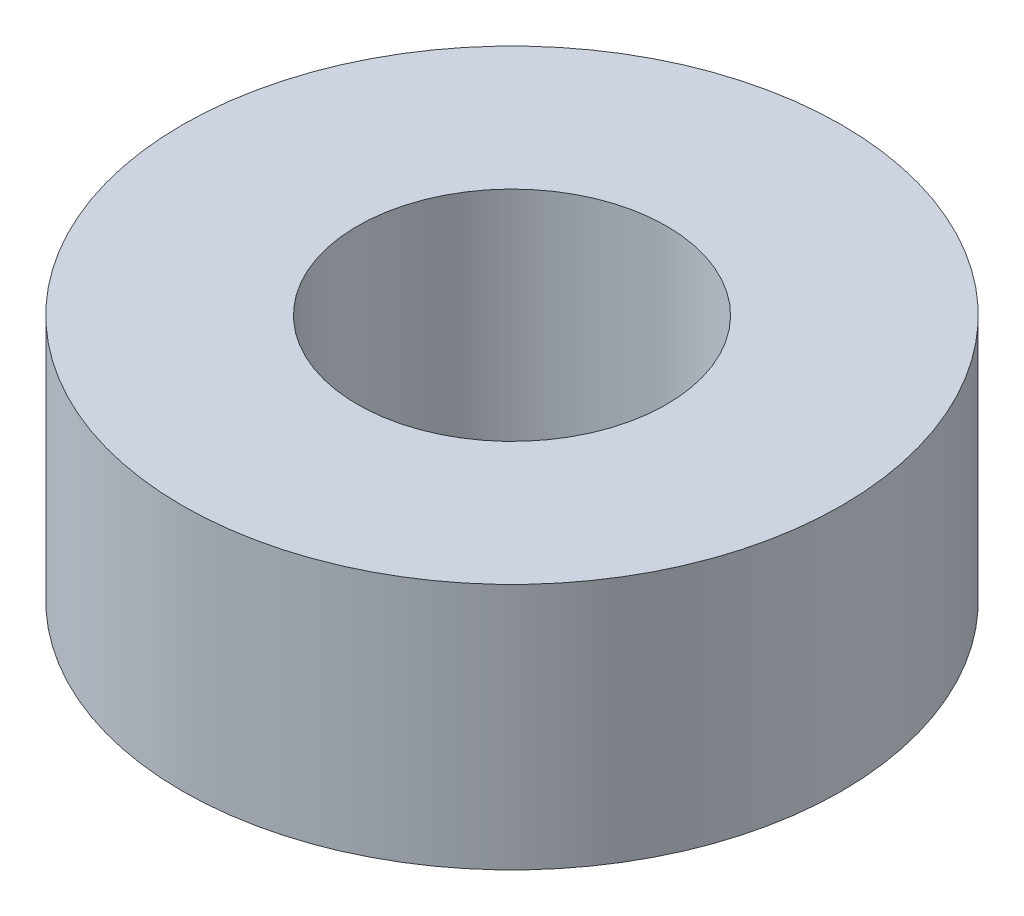
from build123d import *

# Parameters (mm, degrees)
SKETCH2_R           = 20.32
SKETCH2_R_2         = 9.525
BOSS_EXTRUDE1_DEPTH = 15.24


with BuildPart() as part:
    # Sketch2 → Boss-Extrude1 (new body)
    with BuildSketch(Plane(origin=(0, 0, 0), x_dir=(1, 0, 0), z_dir=(0, 1, 0))):
        with Locations(Location((0, 0, 0), (0, 0, 90))):
            Circle(SKETCH2_R)
        with Locations(Location((0, 0, 0), (0, 0, 90))):
            Circle(SKETCH2_R_2, mode=Mode.SUBTRACT)
    extrude(amount=BOSS_EXTRUDE1_DEPTH)


solid = part.part
